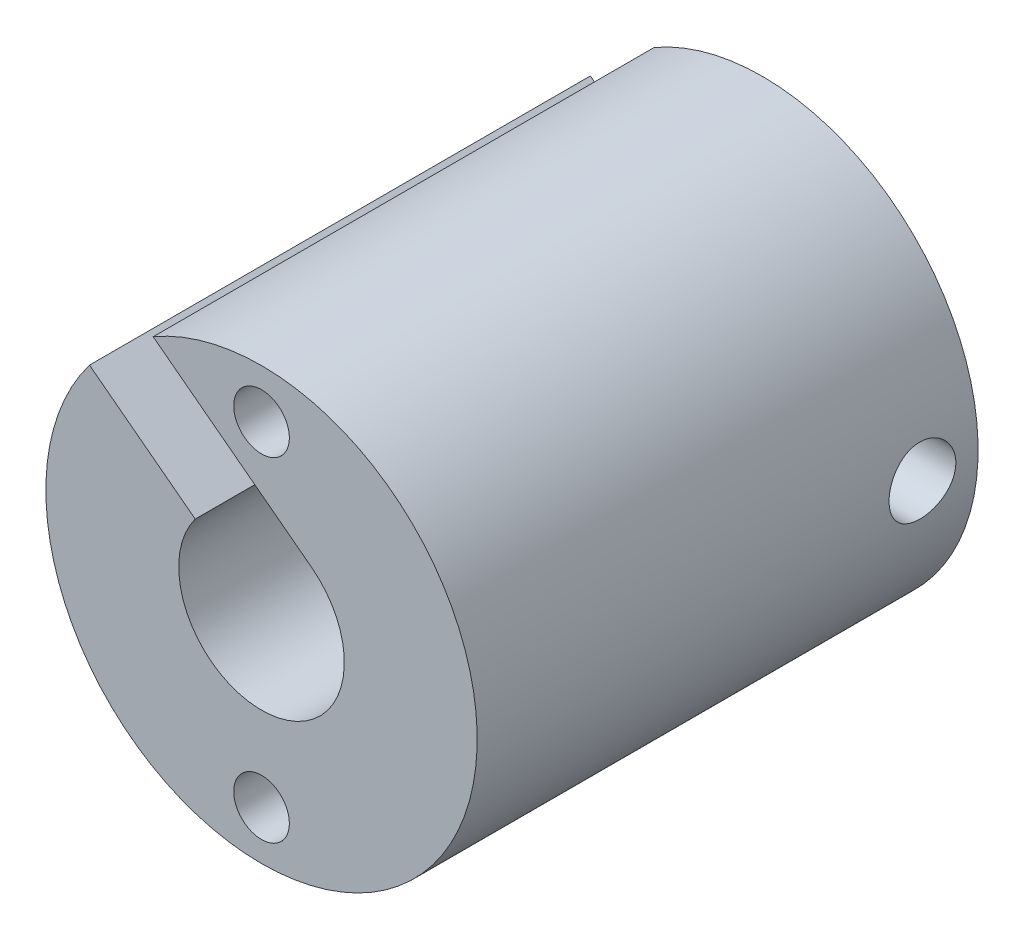
from build123d import *

# Parameters (mm, degrees)
SKETCH_1_R               = 7.75
SKETCH_1_R_2             = 2.975
SKETCH_1_R_3             = 1
EXTRUDE_1_DEPTH          = 18
CUT_EXTRUDE_1_DEPTH      = 22.074273416
CUT_EXTRUDE_1_DEPTH_BACK = 22.074273416
SKETCH_2_R               = 1.2
CUT_EXTRUDE_2_DEPTH      = 22.074273575


with BuildPart() as part:
    # 草图1 → 凸台-拉伸1 (new body)
    with BuildSketch(Plane.XY):
        Circle(SKETCH_1_R)
        Circle(SKETCH_1_R_2, mode=Mode.SUBTRACT)
        with Locations((0, 6)):
            Circle(SKETCH_1_R_3, mode=Mode.SUBTRACT)
        with Locations((0, -6)):
            Circle(SKETCH_1_R_3, mode=Mode.SUBTRACT)
    extrude(amount=EXTRUDE_1_DEPTH)

    # 草图2 → 切除-拉伸1 (cut, two sides: drawn at the far end of the back side and taken through both)
    with BuildSketch(Plane(origin=(0, 0, 0), x_dir=(0, 0, -1), z_dir=(1, 0, 0)).offset(-CUT_EXTRUDE_1_DEPTH_BACK)):
        with Locations((-2, 0)):
            Circle(SKETCH_2_R)
    extrude(amount=CUT_EXTRUDE_1_DEPTH + CUT_EXTRUDE_1_DEPTH_BACK, mode=Mode.SUBTRACT)

    # 草图3 → 切除-拉伸2 (cut, through all)
    with BuildSketch(Plane(origin=(0, 0, 0), x_dir=(-1, 0, 0), z_dir=(0, 0, -1))):
        Polygon((-1.801409312, 2.367604167), (3.893770807, 6.700824494), (6.182814137, 6.700824494), (6.182814137, 4.672826698), (2.382658463, 1.781449873), align=None)
    extrude(amount=-CUT_EXTRUDE_2_DEPTH, mode=Mode.SUBTRACT)


solid = part.part
